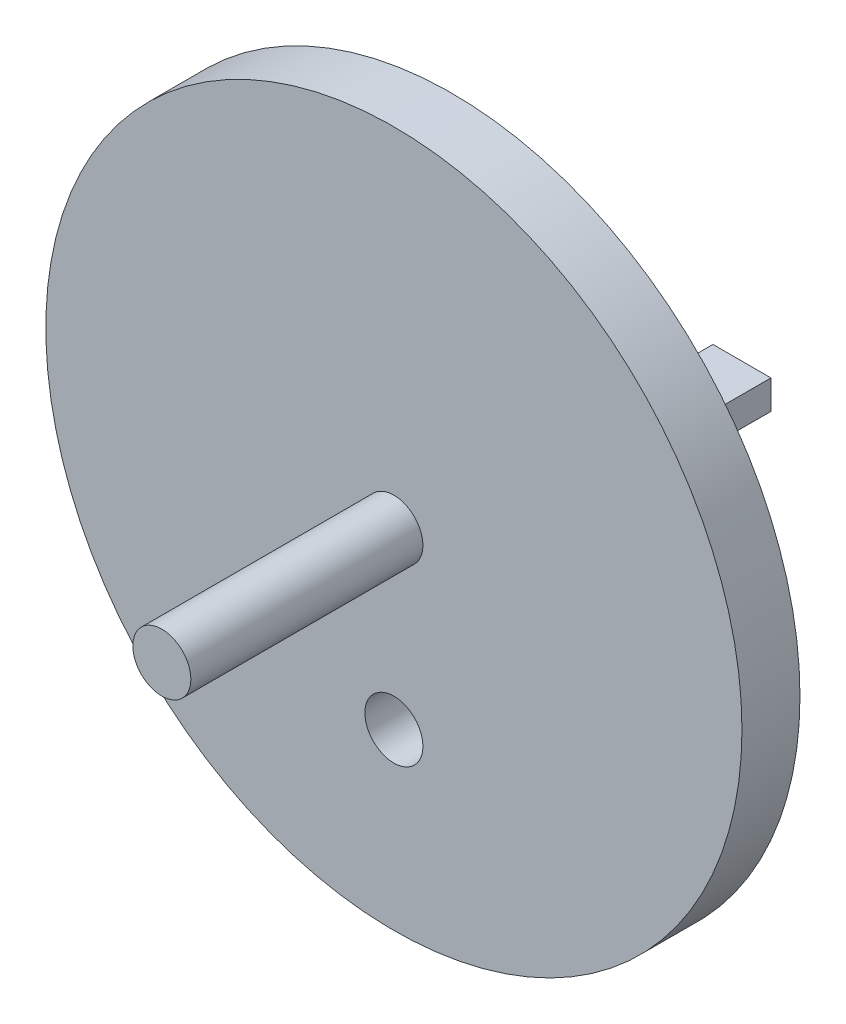
from build123d import *

# Parameters (mm, degrees)
SKETCH1_R           = 60
BOSS_EXTRUDE1_DEPTH = 10
SKETCH2_R           = 5
BOSS_EXTRUDE2_DEPTH = 40
SKETCH5_R           = 5
CUT_EXTRUDE1_DEPTH  = 10
SKETCH6_W           = 10
SKETCH6_H           = 5
BOSS_EXTRUDE4_DEPTH = 10


with BuildPart() as part:
    # Sketch1 → Boss-Extrude1 (new body)
    with BuildSketch(Plane.XY):
        Circle(SKETCH1_R)
    extrude(amount=BOSS_EXTRUDE1_DEPTH)

    # Sketch2 → Boss-Extrude2 (add)
    with BuildSketch(Plane.XY.offset(10)):
        Circle(SKETCH2_R)
    extrude(amount=BOSS_EXTRUDE2_DEPTH)

    # Sketch5 → Cut-Extrude1 (cut)
    with BuildSketch(Plane(origin=(0, 0, 0), x_dir=(-1, 0, 0), z_dir=(0, 0, -1))):
        with Locations((0, -30)):
            Circle(SKETCH5_R)
    extrude(amount=-CUT_EXTRUDE1_DEPTH, mode=Mode.SUBTRACT)

    # Sketch6 → Boss-Extrude4 (add)
    with BuildSketch(Plane(origin=(0, 0, 0), x_dir=(-1, 0, 0), z_dir=(0, 0, -1))):
        with Locations((40, 32.5)):
            Rectangle(SKETCH6_W, SKETCH6_H)
        with Locations((-40, 32.5)):
            Rectangle(SKETCH6_W, SKETCH6_H)
    extrude(amount=BOSS_EXTRUDE4_DEPTH)


solid = part.part
